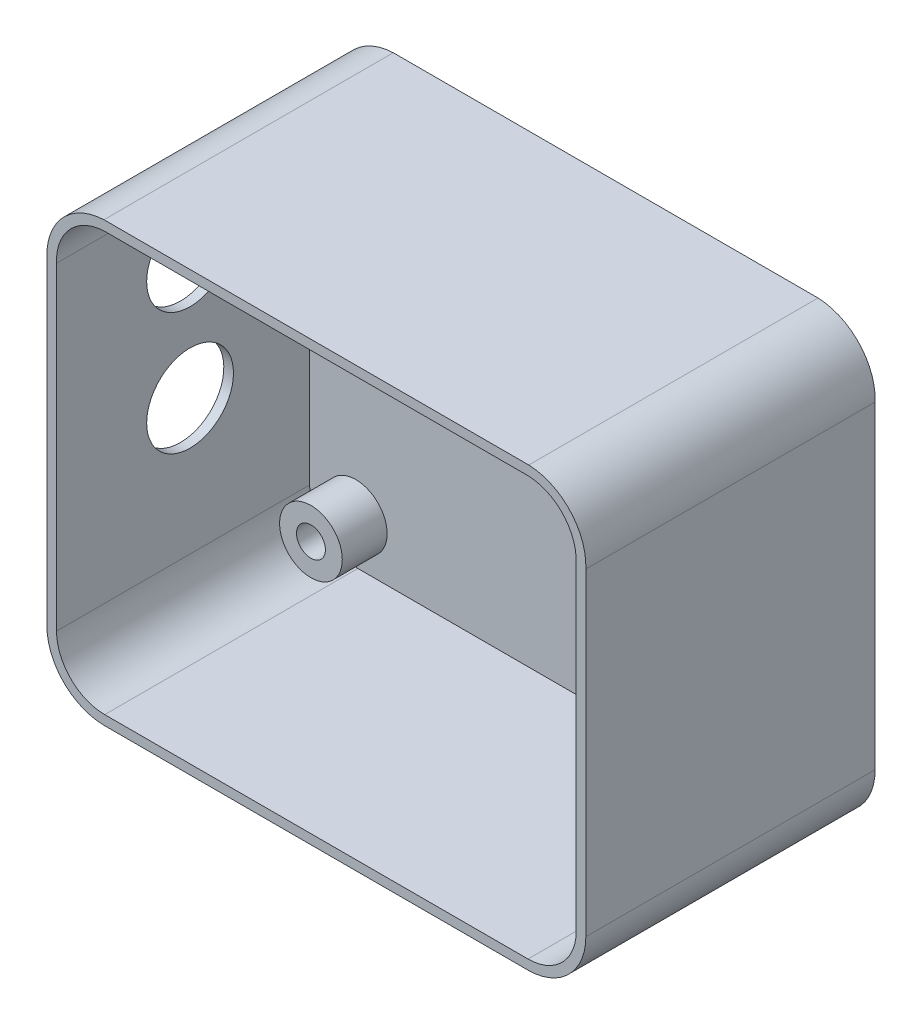
from build123d import *

# Parameters (mm, degrees)
SKETCH1_R           = 1.5
BOSS_EXTRUDE2_DEPTH = 3.75
BOSS_EXTRUDE3_DEPTH = 30
CUT_EXTRUDE1_DEPTH  = 2.4
SKETCH3_R           = 3.25
SKETCH3_R_2         = 1.5
BOSS_EXTRUDE4_DEPTH = 4.65
SKETCH4_R           = 4.5
CUT_EXTRUDE2_DEPTH  = 1


with BuildPart() as part:
    # Sketch1 → Boss-Extrude2 (new body)
    # profile 1 of 2: a face of its own
    with BuildSketch(Plane.XY):
        with BuildLine():
            Line((55.205, 35.540044664), (55.205, 2.5))
            ThreePointArc((55.205, 2.5), (53.740533906, -1.035533906), (50.205, -2.5))
            Line((50.205, -2.5), (6.31, -2.5))
            ThreePointArc((6.31, -2.5), (2.774466094, -1.035533906), (1.31, 2.5))
            Line((1.31, 2.5), (1.31, 35.540044664))
            ThreePointArc((1.31, 35.540044664), (2.66894591, 39.245525041), (6.250024717, 40.9048))
            Line((6.250024717, 40.9048), (50.264975283, 40.9048))
            ThreePointArc((50.264975283, 40.9048), (53.84605409, 39.245525041), (55.205, 35.540044664))
        make_face()
        with BuildLine():
            ThreePointArc((3.81, 2.5), (4.542233047, 0.732233047), (6.31, 0))
            Line((6.31, 0), (50.205, 0))
            ThreePointArc((50.205, 0), (51.972766953, 0.732233047), (52.705, 2.5))
            Line((52.705, 2.5), (52.705, 35.6))
            ThreePointArc((52.705, 35.6), (52.03588526, 37.520159965), (50.205, 38.4048))
            Line((50.205, 38.4048), (6.31, 38.4048))
            ThreePointArc((6.31, 38.4048), (4.47911474, 37.520159965), (3.81, 35.6))
            Line((3.81, 35.6), (3.81, 2.5))
        make_face(mode=Mode.SUBTRACT)
    # profile 2 of 2: a face of its own
    with BuildSketch(Plane.XY):
        with BuildLine():
            Line((3.81, 35.6), (3.81, 2.5))
            ThreePointArc((3.81, 2.5), (4.542233047, 0.732233047), (6.31, 0))
            Line((6.31, 0), (50.205, 0))
            ThreePointArc((50.205, 0), (51.972766953, 0.732233047), (52.705, 2.5))
            Line((52.705, 2.5), (52.705, 35.6))
            ThreePointArc((52.705, 35.6), (52.03588526, 37.520159965), (50.205, 38.4048))
            Line((50.205, 38.4048), (6.31, 38.4048))
            ThreePointArc((6.31, 38.4048), (4.47911474, 37.520159965), (3.81, 35.6))
        make_face()
        with Locations((6.096, 36.2712)):
            Circle(SKETCH1_R, mode=Mode.SUBTRACT)
        with Locations((50.5968, 36.2712)):
            Circle(SKETCH1_R, mode=Mode.SUBTRACT)
        with Locations((50.5968, 2.1336)):
            Circle(SKETCH1_R, mode=Mode.SUBTRACT)
        with Locations((6.096, 2.1336)):
            Circle(SKETCH1_R, mode=Mode.SUBTRACT)
    extrude(amount=BOSS_EXTRUDE2_DEPTH)

    # Sketch1<3> → Boss-Extrude3 (add)
    with BuildSketch(Plane.XY):
        with BuildLine():
            Line((56.205, 35.52036079), (56.205, 2.5))
            ThreePointArc((56.205, 2.5), (54.447640687, -1.742640687), (50.205, -3.5))
            Line((50.205, -3.5), (6.31, -3.5))
            ThreePointArc((6.31, -3.5), (2.067359313, -1.742640687), (0.31, 2.5))
            Line((0.31, 2.5), (0.31, 35.52036079))
            ThreePointArc((0.31, 35.52036079), (1.947918213, 39.938710907), (6.230334295, 41.9048))
            Line((6.230334295, 41.9048), (50.284665705, 41.9048))
            ThreePointArc((50.284665705, 41.9048), (54.567081787, 39.938710907), (56.205, 35.52036079))
        make_face()
        with BuildLine():
            ThreePointArc((55.205, 35.540044664), (53.84605409, 39.245525041), (50.264975283, 40.9048))
            Line((50.264975283, 40.9048), (6.250024717, 40.9048))
            ThreePointArc((6.250024717, 40.9048), (2.66894591, 39.245525041), (1.31, 35.540044664))
            Line((1.31, 35.540044664), (1.31, 2.5))
            ThreePointArc((1.31, 2.5), (2.774466094, -1.035533906), (6.31, -2.5))
            Line((6.31, -2.5), (50.205, -2.5))
            ThreePointArc((50.205, -2.5), (53.740533906, -1.035533906), (55.205, 2.5))
            Line((55.205, 2.5), (55.205, 35.540044664))
        make_face(mode=Mode.SUBTRACT)
    extrude(amount=BOSS_EXTRUDE3_DEPTH)

    # Sketch2 → Cut-Extrude1 (cut)
    with BuildSketch(Plane(origin=(0, 0, 0), x_dir=(-1, 0, 0), z_dir=(0, 0, -1))):
        Polygon((-50.5968, 5.366761507), (-53.3968, 3.750180754), (-53.3968, 0.517019246), (-50.5968, -1.099561507), (-47.7968, 0.517019246), (-47.7968, 3.750180754), align=None)
        Polygon((-47.7968, 37.887780754), (-50.5968, 39.504361507), (-53.3968, 37.887780754), (-53.3968, 34.654619246), (-50.5968, 33.038038493), (-47.7968, 34.654619246), align=None)
        Polygon((-6.096, 39.504361507), (-8.896, 37.887780754), (-8.896, 34.654619246), (-6.096, 33.038038493), (-3.296, 34.654619246), (-3.296, 37.887780754), align=None)
        Polygon((-6.096, 5.366761507), (-8.896, 3.750180754), (-8.896, 0.517019246), (-6.096, -1.099561507), (-3.296, 0.517019246), (-3.296, 3.750180754), align=None)
    extrude(amount=-CUT_EXTRUDE1_DEPTH, mode=Mode.SUBTRACT)

    # Sketch3 → Boss-Extrude4 (add)
    # profile 1 of 4: a face of its own
    with BuildSketch(Plane.XY.offset(3.75)):
        with Locations((6.096, 36.2712)):
            Circle(SKETCH3_R)
        with Locations(Location((6.096, 36.2712, 0), (0, 0, 180))):
            Circle(SKETCH3_R_2, mode=Mode.SUBTRACT)
    # profile 2 of 4: a face of its own
    with BuildSketch(Plane.XY.offset(3.75)):
        with Locations((6.096, 2.1336)):
            Circle(SKETCH3_R)
        with Locations(Location((6.096, 2.1336, 0), (0, 0, 180))):
            Circle(SKETCH3_R_2, mode=Mode.SUBTRACT)
    # profile 3 of 4: a face of its own
    with BuildSketch(Plane.XY.offset(3.75)):
        with Locations((50.5968, 2.1336)):
            Circle(SKETCH3_R)
        with Locations(Location((50.5968, 2.1336, 0), (0, 0, 180))):
            Circle(SKETCH3_R_2, mode=Mode.SUBTRACT)
    # profile 4 of 4: a face of its own
    with BuildSketch(Plane.XY.offset(3.75)):
        with Locations((50.5968, 36.2712)):
            Circle(SKETCH3_R)
        with Locations(Location((50.5968, 36.2712, 0), (0, 0, 180))):
            Circle(SKETCH3_R_2, mode=Mode.SUBTRACT)
    extrude(amount=BOSS_EXTRUDE4_DEPTH)

    # Sketch4 → Cut-Extrude2 (cut)
    with BuildSketch(Plane.ZY.offset(-0.31)):
        with Locations(Location((16.15, 29.21, 0), (0, 0, 270))):
            Circle(SKETCH4_R)
        with Locations(Location((16.15, 16.51, 0), (0, 0, 270))):
            Circle(SKETCH4_R)
    extrude(amount=-CUT_EXTRUDE2_DEPTH, mode=Mode.SUBTRACT)


solid = part.part
